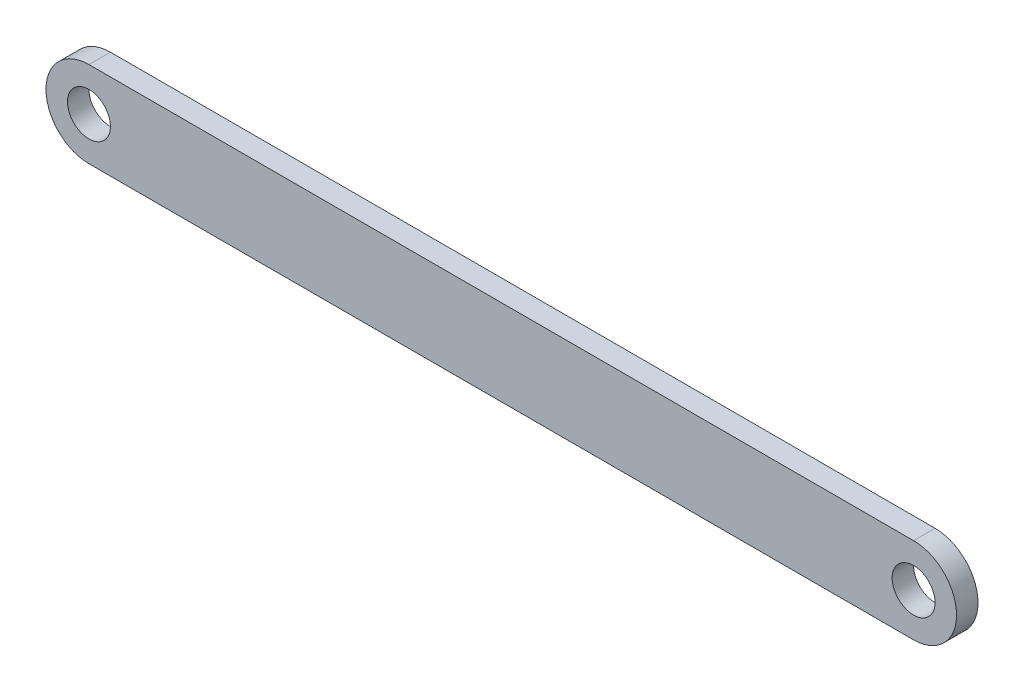
from build123d import *

# Parameters (mm, degrees)
SKETCH1_R           = 31.75
BOSS_EXTRUDE1_DEPTH = 15.875


with BuildPart() as part:
    # Sketch1 → Boss-Extrude1 (new, symmetric)
    with BuildSketch(Plane.XY):
        with BuildLine():
            Line((-609.6, 63.657439452), (609.6, 63.657439452))
            ThreePointArc((609.6, 63.657439452), (673.1, 0.157439452), (609.6, -63.342560548))
            Line((609.6, -63.342560548), (-609.6, -63.342560548))
            ThreePointArc((-609.6, -63.342560548), (-673.1, 0.157439452), (-609.6, 63.657439452))
        make_face()
        with Locations((-609.6, 0.157439452)):
            Circle(SKETCH1_R, mode=Mode.SUBTRACT)
        with Locations((609.6, 0.157439452)):
            Circle(SKETCH1_R, mode=Mode.SUBTRACT)
    extrude(amount=BOSS_EXTRUDE1_DEPTH, both=True)


solid = part.part
